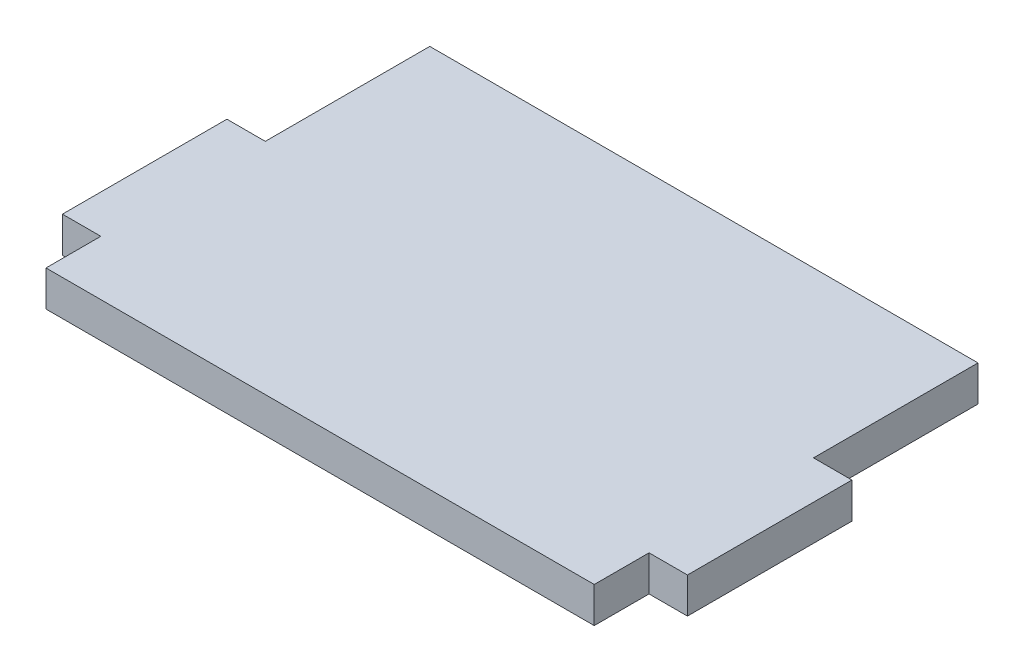
from build123d import *

# Parameters (mm, degrees)
SKETCH1_W           = 20
SKETCH1_H           = 10
BOSS_EXTRUDE1_DEPTH = 1.3
SKETCH2_W           = 1.4
SKETCH2_H           = 6
BOSS_EXTRUDE2_DEPTH = 1.3
SKETCH3_W           = 20
SKETCH3_H           = 4
BOSS_EXTRUDE3_DEPTH = 1.3


with BuildPart() as part:
    # Sketch1 → Boss-Extrude1 (new body)
    with BuildSketch(Plane(origin=(0, 0, 0), x_dir=(1, 0, 0), z_dir=(0, 1, 0))):
        Rectangle(SKETCH1_W, SKETCH1_H)
    extrude(amount=BOSS_EXTRUDE1_DEPTH)

    # Sketch2 → Boss-Extrude2 (add)
    with BuildSketch(Plane(origin=(0, 1.3, 0), x_dir=(1, 0, 0), z_dir=(0, 1, 0))):
        with Locations((-10.7, 0)):
            Rectangle(SKETCH2_W, SKETCH2_H)
        with Locations((10.7, 0)):
            Rectangle(SKETCH2_W, SKETCH2_H)
    extrude(amount=-BOSS_EXTRUDE2_DEPTH)

    # Sketch3 → Boss-Extrude3 (add)
    with BuildSketch(Plane(origin=(0, 1.3, 0), x_dir=(1, 0, 0), z_dir=(0, 1, 0))):
        with Locations((0, 7)):
            Rectangle(SKETCH3_W, SKETCH3_H)
    extrude(amount=-BOSS_EXTRUDE3_DEPTH)


solid = part.part
